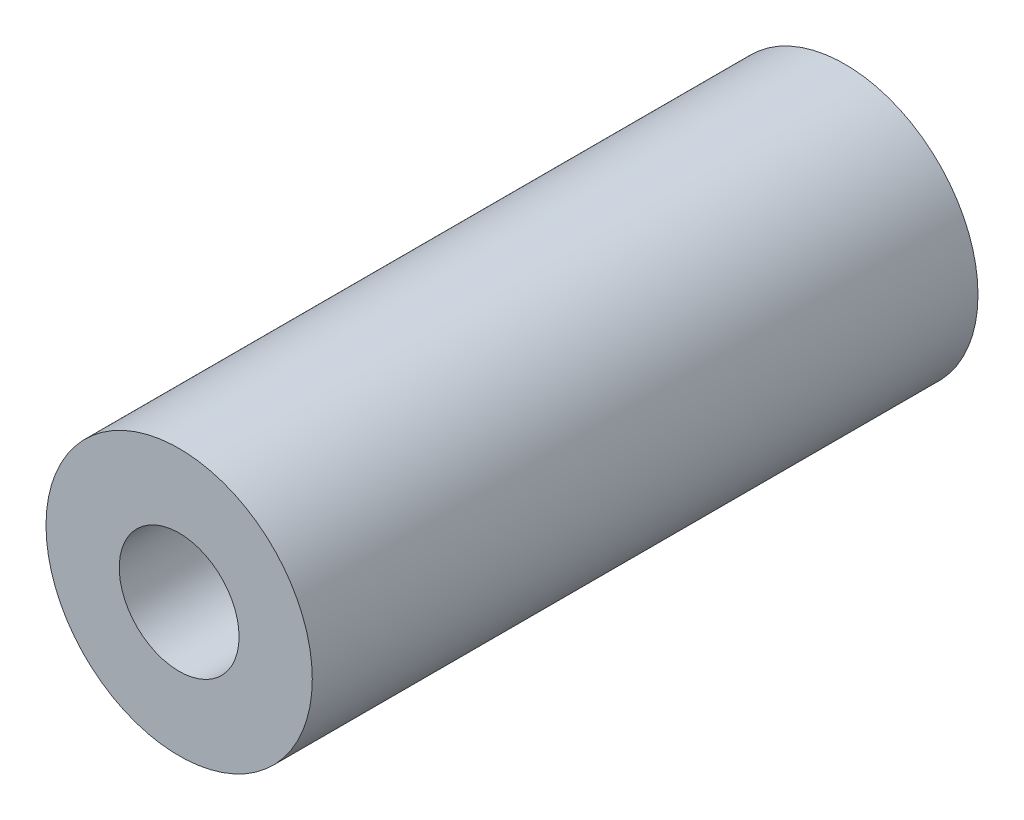
from build123d import *

# Parameters (mm, degrees)
SKETCH_1_R      = 20
SKETCH_1_R_2    = 9
EXTRUDE_1_DEPTH = 100


with BuildPart() as part:
    # 草图1 → 凸台-拉伸1 (new body)
    with BuildSketch(Plane.XY):
        with Locations((205.348971612, 114.766543298)):
            Circle(SKETCH_1_R)
        with Locations((205.348971612, 114.766543298)):
            Circle(SKETCH_1_R_2, mode=Mode.SUBTRACT)
    extrude(amount=-EXTRUDE_1_DEPTH)


solid = part.part
